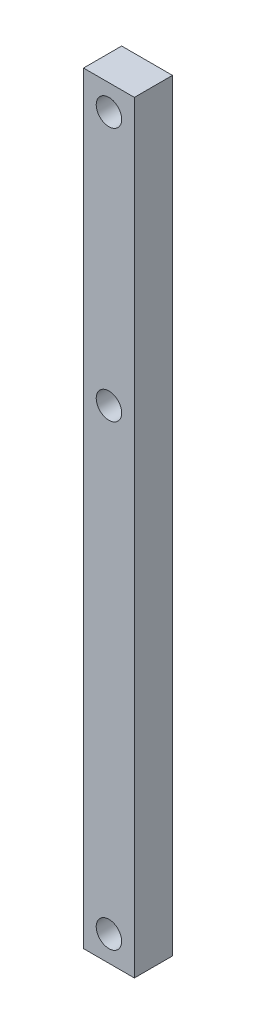
from build123d import *

# Parameters (mm, degrees)
SKETCH2_W           = 20
SKETCH2_H           = 300
BOSS_EXTRUDE1_DEPTH = 15
SKETCH3_R           = 5
CUT_EXTRUDE1_DEPTH  = 15


with BuildPart() as part:
    # Sketch2 → Boss-Extrude1 (new body)
    with BuildSketch(Plane.XY):
        Rectangle(SKETCH2_W, SKETCH2_H)
    extrude(amount=BOSS_EXTRUDE1_DEPTH)

    # Sketch3 → Cut-Extrude1 (cut)
    with BuildSketch(Plane.XY.offset(15)):
        with Locations((0, 140)):
            Circle(SKETCH3_R)
        with Locations((0, -140)):
            Circle(SKETCH3_R)
        with Locations((0, 40)):
            Circle(SKETCH3_R)
    extrude(amount=-CUT_EXTRUDE1_DEPTH, mode=Mode.SUBTRACT)


solid = part.part
